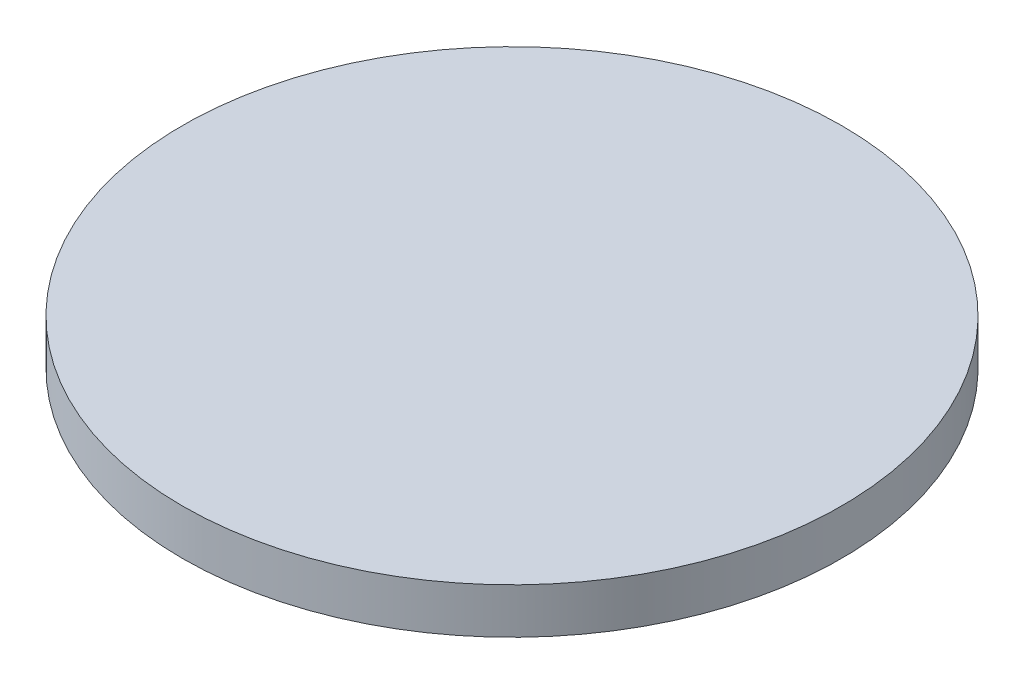
from build123d import *

# Parameters (mm, degrees)
CROQUIS1_R              = 36.25
SALIENTE_EXTRUIR1_DEPTH = 5


with BuildPart() as part:
    # Croquis1 → Saliente-Extruir1 (new body)
    with BuildSketch(Plane(origin=(0, 0, 0), x_dir=(1, 0, 0), z_dir=(0, 1, 0))):
        with Locations(Location((0, 0, 0), (0, 0, 270))):
            Circle(CROQUIS1_R)
    extrude(amount=SALIENTE_EXTRUIR1_DEPTH)


solid = part.part
